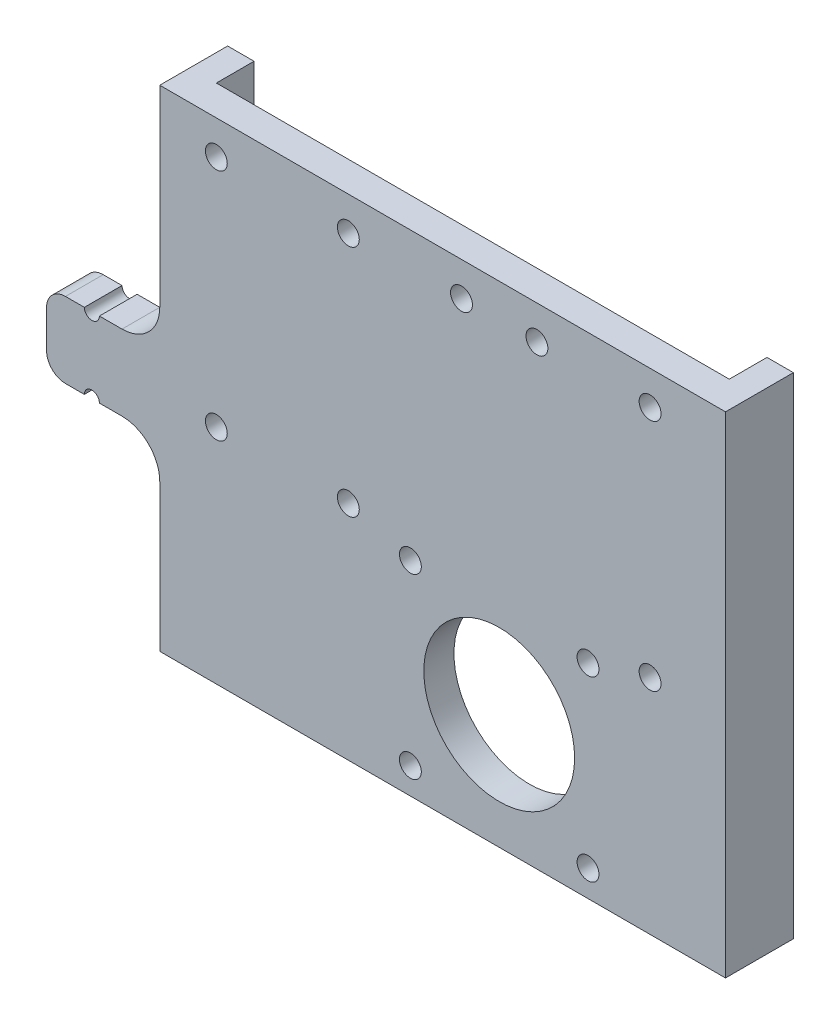
from build123d import *

# Parameters (mm, degrees)
SKETCH1_W            = 100
SKETCH1_H            = 130
BOSS_EXTRUDE1_DEPTH  = 8
M5_CLEARANCE_HOLE1_D = 5.8
SKETCH6_R            = 20
CUT_EXTRUDE1_DEPTH   = 10
SKETCH9_W            = 40
SKETCH9_H            = 130
SKETCH9_W_2          = 10
BOSS_EXTRUDE2_DEPTH  = 8
M5_CLEARANCE_HOLE2_D = 5.8
SKETCH13_W           = 7
SKETCH13_H           = 130
BOSS_EXTRUDE3_DEPTH  = 10
SKETCH14_W           = 30
SKETCH14_H           = 20
BOSS_EXTRUDE4_DEPTH  = 10
FILLET1_R            = 10
FILLET2_R            = 5
CUT_EXTRUDE2_REACH   = 138.839


with BuildPart() as part:
    # Sketch1 → Boss-Extrude1 (new body)
    with BuildSketch(Plane.XY):
        Rectangle(SKETCH1_W, SKETCH1_H)
    extrude(amount=BOSS_EXTRUDE1_DEPTH)

    # M5 Clearance Hole1 (through all)
    with Locations(Plane.XY.offset(8)):
        with Locations((-40, 6), (40, 6), (-40, -56), (40, -56), (-23.55, 58), (23.55, 58), (-23.55, 10.9), (23.55, 10.9), (-10, -56), (10, -56)):
            Hole(M5_CLEARANCE_HOLE1_D / 2)

    # Sketch6 → Cut-Extrude1 (cut)
    with BuildSketch(Plane.XY.offset(8)):
        with Locations((0, 34.5)):
            Circle(SKETCH6_R)
    extrude(amount=-CUT_EXTRUDE1_DEPTH, mode=Mode.SUBTRACT)

    # Sketch9 → Boss-Extrude2 (add)
    with BuildSketch(Plane.XY.offset(8)):
        with Locations((-70, 0)):
            Rectangle(SKETCH9_W, SKETCH9_H)
        with Locations((55, 0)):
            Rectangle(SKETCH9_W_2, SKETCH9_H)
    extrude(amount=-BOSS_EXTRUDE2_DEPTH)

    # M5 Clearance Hole2 (through all)
    with Locations(Plane.XY.offset(8)):
        with Locations((-75, 6), (-75, -56)):
            Hole(M5_CLEARANCE_HOLE2_D / 2)

    # Sketch13 → Boss-Extrude3 (add)
    with BuildSketch(Plane(origin=(0, 0, 0), x_dir=(-1, 0, 0), z_dir=(0, 0, -1))):
        with Locations((-56.5, 0)):
            Rectangle(SKETCH13_W, SKETCH13_H)
        with Locations((86.5, 0)):
            Rectangle(SKETCH13_W, SKETCH13_H)
    extrude(amount=BOSS_EXTRUDE3_DEPTH)

    # Sketch14 → Boss-Extrude4 (add)
    with BuildSketch(Plane.XY.offset(8)):
        with Locations((-105, 6)):
            Rectangle(SKETCH14_W, SKETCH14_H)
    extrude(amount=-BOSS_EXTRUDE4_DEPTH)

    # Fillet1
    fillet1_edges = [part.edges().sort_by_distance(p)[0] for p in [
        (-90, 16, 3),
        (-90, -4, 3),
    ]]
    fillet(fillet1_edges, radius=FILLET1_R)

    # Fillet2
    fillet2_edges = [part.edges().sort_by_distance(p)[0] for p in [
        (-120, -4, 3),
        (-120, 16, 3),
    ]]
    fillet(fillet2_edges, radius=FILLET2_R)

    # Sketch15 → Cut-Extrude2 (cut, up to next)
    with BuildSketch(Plane(origin=(0, 0, -2), x_dir=(-1, 0, 0), z_dir=(0, 0, -1)), mode=Mode.PRIVATE) as cut_extrude2_sk1:
        with BuildLine():
            Line((106, 16), (110, 16))
            ThreePointArc((110, 16), (108, 14), (106, 16))
        make_face()
    cut_extrude2_tool1 = extrude(cut_extrude2_sk1.sketch, amount=-CUT_EXTRUDE2_REACH, mode=Mode.PRIVATE) & part.part
    # Sketch15 → Cut-Extrude2 (cut, up to next)
    with BuildSketch(Plane(origin=(0, 0, -2), x_dir=(-1, 0, 0), z_dir=(0, 0, -1)), mode=Mode.PRIVATE) as cut_extrude2_sk2:
        with BuildLine():
            Line((110, -4), (106, -4))
            ThreePointArc((106, -4), (108, -2), (110, -4))
        make_face()
    cut_extrude2_tool2 = extrude(cut_extrude2_sk2.sketch, amount=-CUT_EXTRUDE2_REACH, mode=Mode.PRIVATE) & part.part
    add(cut_extrude2_tool1.solids().sort_by_distance((-108, 15.151174, -2))[0], mode=Mode.SUBTRACT)
    add(cut_extrude2_tool2.solids().sort_by_distance((-108, -3.151174, -2))[0], mode=Mode.SUBTRACT)


with BuildPart() as body_2:
    # Mirror1: mirrored copy
    add(part.part.mirror(Plane.ZX))


solid = body_2.part
